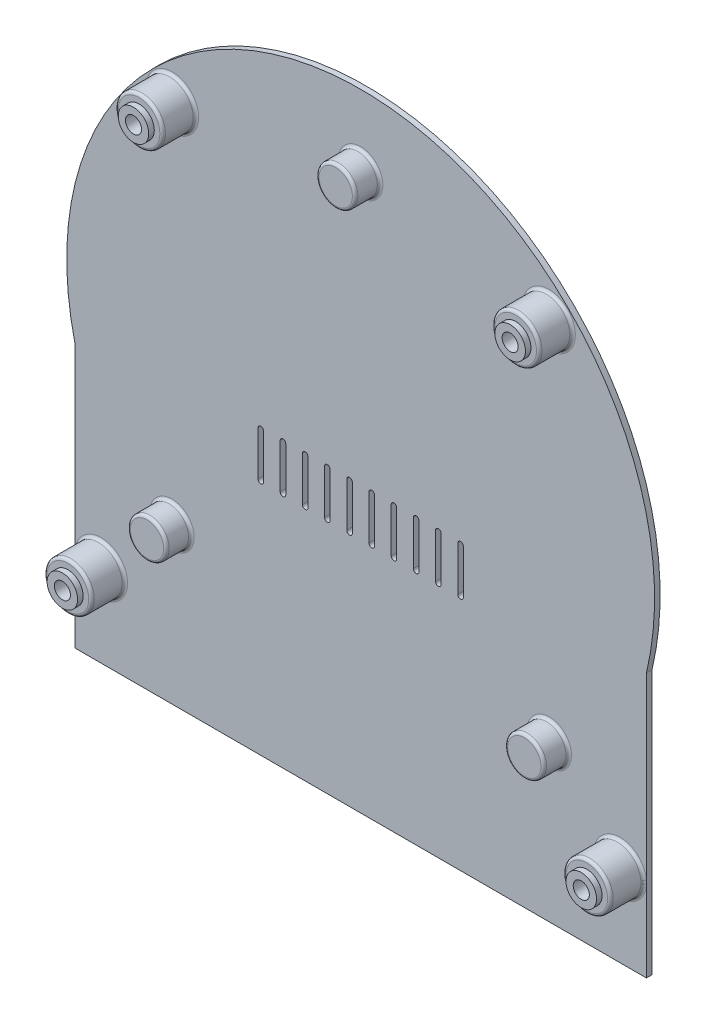
from build123d import *

# Parameters (mm, degrees)
BOSS_EXTRU_1_DEPTH                                 = 1
ESQUISSE3_R                                        = 4.25
BOSS_EXTRU_2_DEPTH                                 = 6
ESQUISSE4_R                                        = 2.75
BOSS_EXTRU_3_DEPTH                                 = 1
CHAMBRAGE_POUR_VIS_T_TE_RONDE_BOMB_E_M_D           = 2.9
CHAMBRAGE_POUR_VIS_T_TE_RONDE_BOMB_E_M_CBORE_D     = 6
CHAMBRAGE_POUR_VIS_T_TE_RONDE_BOMB_E_M_CBORE_DEPTH = 5.1
ESQUISSE8_R                                        = 3.5
BOSS_EXTRU_4_DEPTH                                 = 4.5
CONG_1_R                                           = 0.5
ENL_V_MAT_EXTRU_1_DEPTH                            = 5
ENL_V_MAT_EXTRU_2_DEPTH                            = 81.435196972
CONG_1_OF_SYM_TRIE1_R                              = 0.5


with BuildPart() as part:
    # Esquisse2 → Boss.-Extru.1 (new body)
    with BuildSketch(Plane.XY):
        with BuildLine():
            Line((-51.5, -12.392372654), (-51.5, -60))
            Line((-51.5, -60), (51.5, -60))
            Line((51.5, -60), (51.5, -12.392372654))
            ThreePointArc((51.5, -12.392372654), (0, 52.97), (-51.5, -12.392372654))
        make_face()
    extrude(amount=BOSS_EXTRU_1_DEPTH)

    # Esquisse3 → Boss.-Extru.2 (add)
    with BuildSketch(Plane.XY.offset(1)):
        with Locations((-33.941125497, 33.941125497)):
            Circle(ESQUISSE3_R)
        with Locations((-46.757087022, -45.15279408)):
            Circle(ESQUISSE3_R)
    boss_extru_2 = extrude(amount=BOSS_EXTRU_2_DEPTH)

    # Esquisse4 → Boss.-Extru.3 (add)
    with BuildSketch(Plane.XY.offset(7)):
        with Locations((-33.941125497, 33.941125497)):
            Circle(ESQUISSE4_R)
        with Locations((-46.757087022, -45.15279408)):
            Circle(ESQUISSE4_R)
    boss_extru_3 = extrude(amount=BOSS_EXTRU_3_DEPTH)

    # Chambrage pour vis à tête ronde bombée M2.52 (through all)
    with Locations(Plane(origin=(0, 0, 0), x_dir=(-1, 0, 0), z_dir=(0, 0, -1))):
        with Locations((33.941125497, 33.941125497), (46.757087022, -45.15279408)):
            chambrage_pour_vis_t_te_ronde_bomb_e_m = CounterBoreHole(CHAMBRAGE_POUR_VIS_T_TE_RONDE_BOMB_E_M_D / 2, CHAMBRAGE_POUR_VIS_T_TE_RONDE_BOMB_E_M_CBORE_D / 2, CHAMBRAGE_POUR_VIS_T_TE_RONDE_BOMB_E_M_CBORE_DEPTH)

    # Esquisse8 → Boss.-Extru.4 (add)
    with BuildSketch(Plane.XY.offset(1)):
        with Locations((0, 40)):
            Circle(ESQUISSE8_R)
        with Locations((-34, -32)):
            Circle(ESQUISSE8_R)
        with Locations((34, -32)):
            Circle(ESQUISSE8_R)
    extrude(amount=BOSS_EXTRU_4_DEPTH)

    # Congé1
    cong_1_edges = [part.edges().sort_by_distance(p)[0] for p in [
        (-38.191125497, 33.941125497, 1),
        (-38.191125497, 33.941125497, 7),
        (-51.007087022, -45.15279408, 1),
        (-51.007087022, -45.15279408, 7),
        (-3.5, 40, 1),
        (-3.5, 40, 5.5),
        (-37.5, -32, 1),
        (-37.5, -32, 5.5),
        (30.5, -32, 1),
        (30.5, -32, 5.5),
    ]]
    fillet(cong_1_edges, radius=CONG_1_R)

    # Esquisse9 → Enlèv. mat.-Extru.1 (cut)
    with BuildSketch(Plane(origin=(0, 0, 0), x_dir=(-1, 0, 0), z_dir=(0, 0, -1))):
        with BuildLine():
            ThreePointArc((-33.750869568, -30.520833333), (-34, -30.25), (-34.249130432, -30.520833333))
            ThreePointArc((-34.249130432, -30.520833333), (-34.388228568, -30.551111261), (-34.52383005, -30.594438874))
            ThreePointArc((-34.52383005, -30.594438874), (-34.875, -30.484455543), (-34.955336616, -30.843569306))
            ThreePointArc((-34.955336616, -30.843569306), (-35.060660172, -30.939339828), (-35.156430694, -31.044663384))
            ThreePointArc((-35.156430694, -31.044663384), (-35.515544457, -31.125), (-35.405561126, -31.47616995))
            ThreePointArc((-35.405561126, -31.47616995), (-35.448888739, -31.611771432), (-35.479166667, -31.750869568))
            ThreePointArc((-35.479166667, -31.750869568), (-35.75, -32), (-35.479166667, -32.249130432))
            ThreePointArc((-35.479166667, -32.249130432), (-35.448888739, -32.388228568), (-35.405561126, -32.52383005))
            ThreePointArc((-35.405561126, -32.52383005), (-35.515544457, -32.875), (-35.156430694, -32.955336616))
            ThreePointArc((-35.156430694, -32.955336616), (-35.060660172, -33.060660172), (-34.955336616, -33.156430694))
            ThreePointArc((-34.955336616, -33.156430694), (-34.875, -33.515544457), (-34.52383005, -33.405561126))
            ThreePointArc((-34.52383005, -33.405561126), (-34.388228568, -33.448888739), (-34.249130432, -33.479166667))
            ThreePointArc((-34.249130432, -33.479166667), (-34, -33.75), (-33.750869568, -33.479166667))
            ThreePointArc((-33.750869568, -33.479166667), (-33.611771432, -33.448888739), (-33.47616995, -33.405561126))
            ThreePointArc((-33.47616995, -33.405561126), (-33.125, -33.515544457), (-33.044663384, -33.156430694))
            ThreePointArc((-33.044663384, -33.156430694), (-32.939339828, -33.060660172), (-32.843569306, -32.955336616))
            ThreePointArc((-32.843569306, -32.955336616), (-32.484455543, -32.875), (-32.594438874, -32.52383005))
            ThreePointArc((-32.594438874, -32.52383005), (-32.551111261, -32.388228568), (-32.520833333, -32.249130432))
            ThreePointArc((-32.520833333, -32.249130432), (-32.25, -32), (-32.520833333, -31.750869568))
            ThreePointArc((-32.520833333, -31.750869568), (-32.551111261, -31.611771432), (-32.594438874, -31.47616995))
            ThreePointArc((-32.594438874, -31.47616995), (-32.484455543, -31.125), (-32.843569306, -31.044663384))
            ThreePointArc((-32.843569306, -31.044663384), (-32.939339828, -30.939339828), (-33.044663384, -30.843569306))
            ThreePointArc((-33.044663384, -30.843569306), (-33.125, -30.484455543), (-33.47616995, -30.594438874))
            ThreePointArc((-33.47616995, -30.594438874), (-33.611771432, -30.551111261), (-33.750869568, -30.520833333))
        make_face()
        with BuildLine():
            ThreePointArc((34.249130432, -30.520833333), (34, -30.25), (33.750869568, -30.520833333))
            ThreePointArc((33.750869568, -30.520833333), (33.611771432, -30.551111261), (33.47616995, -30.594438874))
            ThreePointArc((33.47616995, -30.594438874), (33.125, -30.484455543), (33.044663384, -30.843569306))
            ThreePointArc((33.044663384, -30.843569306), (32.939339828, -30.939339828), (32.843569306, -31.044663384))
            ThreePointArc((32.843569306, -31.044663384), (32.484455543, -31.125), (32.594438874, -31.47616995))
            ThreePointArc((32.594438874, -31.47616995), (32.551111261, -31.611771432), (32.520833333, -31.750869568))
            ThreePointArc((32.520833333, -31.750869568), (32.25, -32), (32.520833333, -32.249130432))
            ThreePointArc((32.520833333, -32.249130432), (32.551111261, -32.388228568), (32.594438874, -32.52383005))
            ThreePointArc((32.594438874, -32.52383005), (32.484455543, -32.875), (32.843569306, -32.955336616))
            ThreePointArc((32.843569306, -32.955336616), (32.939339828, -33.060660172), (33.044663384, -33.156430694))
            ThreePointArc((33.044663384, -33.156430694), (33.125, -33.515544457), (33.47616995, -33.405561126))
            ThreePointArc((33.47616995, -33.405561126), (33.611771432, -33.448888739), (33.750869568, -33.479166667))
            ThreePointArc((33.750869568, -33.479166667), (34, -33.75), (34.249130432, -33.479166667))
            ThreePointArc((34.249130432, -33.479166667), (34.388228568, -33.448888739), (34.52383005, -33.405561126))
            ThreePointArc((34.52383005, -33.405561126), (34.875, -33.515544457), (34.955336616, -33.156430694))
            ThreePointArc((34.955336616, -33.156430694), (35.060660172, -33.060660172), (35.156430694, -32.955336616))
            ThreePointArc((35.156430694, -32.955336616), (35.515544457, -32.875), (35.405561126, -32.52383005))
            ThreePointArc((35.405561126, -32.52383005), (35.448888739, -32.388228568), (35.479166667, -32.249130432))
            ThreePointArc((35.479166667, -32.249130432), (35.75, -32), (35.479166667, -31.750869568))
            ThreePointArc((35.479166667, -31.750869568), (35.448888739, -31.611771432), (35.405561126, -31.47616995))
            ThreePointArc((35.405561126, -31.47616995), (35.515544457, -31.125), (35.156430694, -31.044663384))
            ThreePointArc((35.156430694, -31.044663384), (35.060660172, -30.939339828), (34.955336616, -30.843569306))
            ThreePointArc((34.955336616, -30.843569306), (34.875, -30.484455543), (34.52383005, -30.594438874))
            ThreePointArc((34.52383005, -30.594438874), (34.388228568, -30.551111261), (34.249130432, -30.520833333))
        make_face()
        with BuildLine():
            ThreePointArc((0.249130432, 41.479166667), (0, 41.75), (-0.249130432, 41.479166667))
            ThreePointArc((-0.249130432, 41.479166667), (-0.388228568, 41.448888739), (-0.52383005, 41.405561126))
            ThreePointArc((-0.52383005, 41.405561126), (-0.875, 41.515544457), (-0.955336616, 41.156430694))
            ThreePointArc((-0.955336616, 41.156430694), (-1.060660172, 41.060660172), (-1.156430694, 40.955336616))
            ThreePointArc((-1.156430694, 40.955336616), (-1.515544457, 40.875), (-1.405561126, 40.52383005))
            ThreePointArc((-1.405561126, 40.52383005), (-1.448888739, 40.388228568), (-1.479166667, 40.249130432))
            ThreePointArc((-1.479166667, 40.249130432), (-1.75, 40), (-1.479166667, 39.750869568))
            ThreePointArc((-1.479166667, 39.750869568), (-1.448888739, 39.611771432), (-1.405561126, 39.47616995))
            ThreePointArc((-1.405561126, 39.47616995), (-1.515544457, 39.125), (-1.156430694, 39.044663384))
            ThreePointArc((-1.156430694, 39.044663384), (-1.060660172, 38.939339828), (-0.955336616, 38.843569306))
            ThreePointArc((-0.955336616, 38.843569306), (-0.875, 38.484455543), (-0.52383005, 38.594438874))
            ThreePointArc((-0.52383005, 38.594438874), (-0.388228568, 38.551111261), (-0.249130432, 38.520833333))
            ThreePointArc((-0.249130432, 38.520833333), (0, 38.25), (0.249130432, 38.520833333))
            ThreePointArc((0.249130432, 38.520833333), (0.388228568, 38.551111261), (0.52383005, 38.594438874))
            ThreePointArc((0.52383005, 38.594438874), (0.875, 38.484455543), (0.955336616, 38.843569306))
            ThreePointArc((0.955336616, 38.843569306), (1.060660172, 38.939339828), (1.156430694, 39.044663384))
            ThreePointArc((1.156430694, 39.044663384), (1.515544457, 39.125), (1.405561126, 39.47616995))
            ThreePointArc((1.405561126, 39.47616995), (1.448888739, 39.611771432), (1.479166667, 39.750869568))
            ThreePointArc((1.479166667, 39.750869568), (1.75, 40), (1.479166667, 40.249130432))
            ThreePointArc((1.479166667, 40.249130432), (1.448888739, 40.388228568), (1.405561126, 40.52383005))
            ThreePointArc((1.405561126, 40.52383005), (1.515544457, 40.875), (1.156430694, 40.955336616))
            ThreePointArc((1.156430694, 40.955336616), (1.060660172, 41.060660172), (0.955336616, 41.156430694))
            ThreePointArc((0.955336616, 41.156430694), (0.875, 41.515544457), (0.52383005, 41.405561126))
            ThreePointArc((0.52383005, 41.405561126), (0.388228568, 41.448888739), (0.249130432, 41.479166667))
        make_face()
    extrude(amount=-ENL_V_MAT_EXTRU_1_DEPTH, mode=Mode.SUBTRACT)

    # Esquisse10 → Enlèv. mat.-Extru.2 (cut, through all)
    with BuildSketch(Plane(origin=(0, 0, 0), x_dir=(-1, 0, 0), z_dir=(0, 0, -1))):
        with BuildLine():
            Line((-1.5, -9.116257269), (-1.5, -17.116257269))
            ThreePointArc((-1.5, -17.116257269), (-2, -17.616257269), (-2.5, -17.116257269))
            Line((-2.5, -17.116257269), (-2.5, -9.116257269))
            ThreePointArc((-2.5, -9.116257269), (-2, -8.616257269), (-1.5, -9.116257269))
        make_face()
        with BuildLine():
            Line((-5.5, -9.116257269), (-5.5, -17.116257269))
            ThreePointArc((-5.5, -17.116257269), (-6, -17.616257269), (-6.5, -17.116257269))
            Line((-6.5, -17.116257269), (-6.5, -9.116257269))
            ThreePointArc((-6.5, -9.116257269), (-6, -8.616257269), (-5.5, -9.116257269))
        make_face()
        with BuildLine():
            Line((-9.5, -9.116257269), (-9.5, -17.116257269))
            ThreePointArc((-9.5, -17.116257269), (-10, -17.616257269), (-10.5, -17.116257269))
            Line((-10.5, -17.116257269), (-10.5, -9.116257269))
            ThreePointArc((-10.5, -9.116257269), (-10, -8.616257269), (-9.5, -9.116257269))
        make_face()
        with BuildLine():
            Line((-13.5, -9.116257269), (-13.5, -17.116257269))
            ThreePointArc((-13.5, -17.116257269), (-14, -17.616257269), (-14.5, -17.116257269))
            Line((-14.5, -17.116257269), (-14.5, -9.116257269))
            ThreePointArc((-14.5, -9.116257269), (-14, -8.616257269), (-13.5, -9.116257269))
        make_face()
        with BuildLine():
            Line((-17.5, -9.116257269), (-17.5, -17.116257269))
            ThreePointArc((-17.5, -17.116257269), (-18, -17.616257269), (-18.5, -17.116257269))
            Line((-18.5, -17.116257269), (-18.5, -9.116257269))
            ThreePointArc((-18.5, -9.116257269), (-18, -8.616257269), (-17.5, -9.116257269))
        make_face()
    enl_v_mat_extru_2 = extrude(amount=-ENL_V_MAT_EXTRU_2_DEPTH, mode=Mode.SUBTRACT)

    # Symétrie1: Boss.-Extru.2, Boss.-Extru.3, Chambrage pour vis à tête ronde bombée M2.52, Enlèv. mat.-Extru.2 across plane
    add(boss_extru_2.mirror(Plane(origin=(0, 0, 0), x_dir=(0, 0, 1), z_dir=(1, 0, 0))))
    add(boss_extru_3.mirror(Plane(origin=(0, 0, 0), x_dir=(0, 0, 1), z_dir=(1, 0, 0))))
    add(chambrage_pour_vis_t_te_ronde_bomb_e_m.mirror(Plane(origin=(0, 0, 0), x_dir=(0, 0, 1), z_dir=(1, 0, 0))), mode=Mode.SUBTRACT)
    add(enl_v_mat_extru_2.mirror(Plane(origin=(0, 0, 0), x_dir=(0, 0, 1), z_dir=(1, 0, 0))), mode=Mode.SUBTRACT)

    # Congé1 of Symétrie1
    cong_1_of_sym_trie1_edges = [part.edges().sort_by_distance(p)[0] for p in [
        (38.191125497, 33.941125497, 1),
        (38.191125497, 33.941125497, 7),
        (51.007087022, -45.15279408, 1),
        (51.007087022, -45.15279408, 7),
        (3.5, 40, 1),
        (3.5, 40, 5.5),
        (37.5, -32, 1),
        (37.5, -32, 5.5),
        (-30.5, -32, 1),
        (-30.5, -32, 5.5),
    ]]
    fillet(cong_1_of_sym_trie1_edges, radius=CONG_1_OF_SYM_TRIE1_R)


solid = part.part
